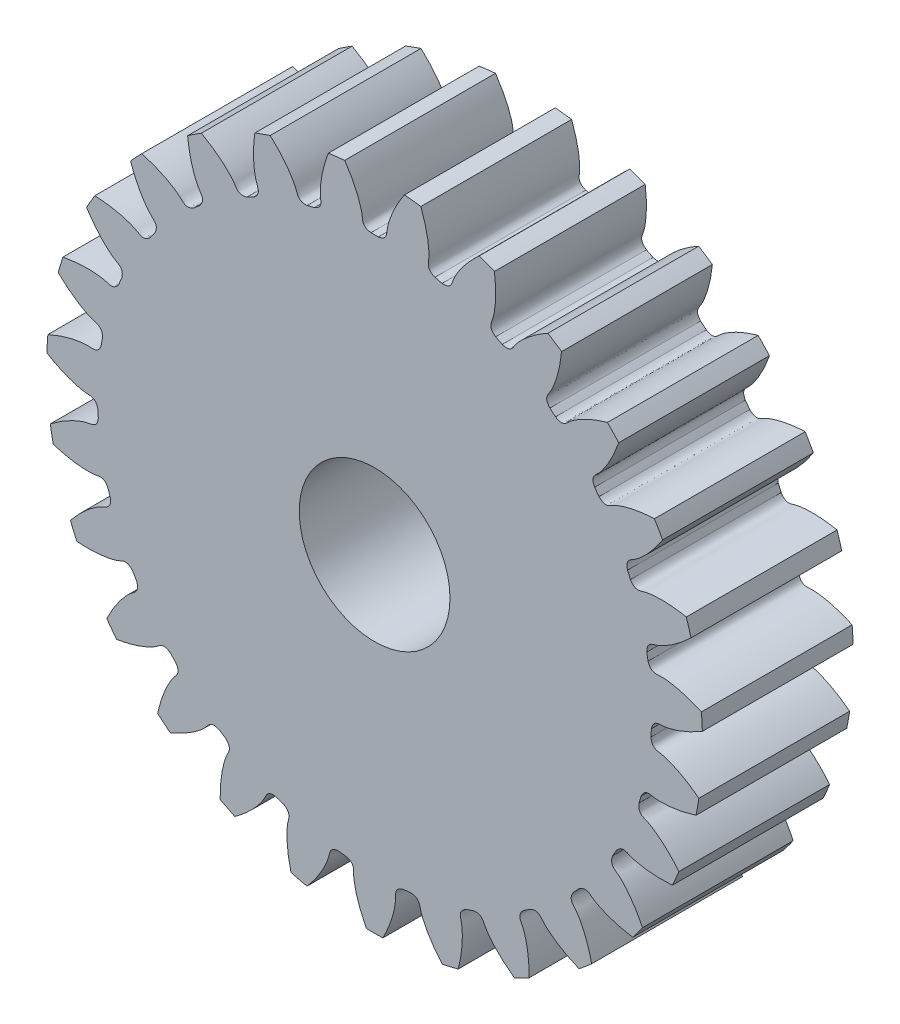
from build123d import *

# Parameters (mm, degrees)
SKETCH_1_R               = 8.700000003
EXTRUDE_1_DEPTH          = 4
CUT_EXTRUDE_1_DEPTH      = 13.937542274
PATTERN_CIRCULAR_1_COUNT = 27
SKETCH_4_R               = 2
CUT_EXTRUDE_2_DEPTH      = 13.934333831


with BuildPart() as part:
    # 草图1 → 凸台-拉伸1 (new body)
    with BuildSketch(Plane.XY):
        Circle(SKETCH_1_R)
    extrude(amount=EXTRUDE_1_DEPTH)

    # 草图2 → 切除-拉伸1 (cut, through all)
    with BuildSketch(Plane.XY):
        with BuildLine():
            ThreePointArc((0.097156647, 7.349357835), (0, 7.35), (-0.097156647, 7.349357835))
            add(Edge.make_bspline(
                [(-0.097156647, 7.349357835), (-0.332065156, 7.387188228), (-0.315047014, 7.52305448), (-0.336367355, 7.659749691), (-0.339792052, 7.67924215), (-0.344194706, 7.701649367), (-0.349687886, 7.726940099), (-0.356390106, 7.755078086), (-0.364416622, 7.786024035), (-0.373882288, 7.819735011), (-0.384900524, 7.85616467), (-0.397583521, 7.89526323), (-0.412042052, 7.936977517), (-0.428385415, 7.981251003), (-0.446721333, 8.028023843), (-0.467155865, 8.077232914), (-0.489793322, 8.128811862), (-0.514736175, 8.182691143), (-0.542084976, 8.238798073), (-0.571938268, 8.297056877), (-0.604392504, 8.357388739), (-0.639541965, 8.419711859), (-0.677478678, 8.483941507), (-0.718292341, 8.54999008), (-0.762070239, 8.617767161), (-0.808897172, 8.687179585), (-0.85885538, 8.758131499), (-0.912024466, 8.830524428), (-0.96848133, 8.904257345), (-1.028300094, 8.979226735), (-1.091552037, 9.055326672), (-1.158305525, 9.132448887), (-1.22862595, 9.210482848), (-1.302575664, 9.289315828), (-1.380213922, 9.368832989), (-1.461596814, 9.448917462), (-1.546777224, 9.52945042), (-1.635804737, 9.610311172), (-1.761228926, 9.719733673), (-1.858936884, 9.799885494), (-1.925888885, 9.852656038)],
                knots=[0, 0, 0, 0, 0.119961604, 0.125268853, 0.131541057, 0.138778215, 0.146980327, 0.156147394, 0.166279415, 0.17737639, 0.18943832, 0.202465204, 0.216457043, 0.231413836, 0.247335583, 0.264222285, 0.282073941, 0.300890552, 0.320672116, 0.341418636, 0.363130109, 0.385806537, 0.409447919, 0.434054256, 0.459625547, 0.486161793, 0.513662993, 0.542129147, 0.571560255, 0.601956318, 0.633317336, 0.665643307, 0.698934234, 0.733190114, 0.768410949, 0.804596738, 0.841747482, 0.87986318, 0.918943832, 1, 1, 1, 1], degree=3))
            ThreePointArc((-1.925888885, 9.852656038), (0, 10.039117442), (1.925888885, 9.852656038))
            add(Edge.make_bspline(
                [(0.097156647, 7.349357835), (0.332065156, 7.387188228), (0.315047014, 7.52305448), (0.336367355, 7.659749691), (0.339792052, 7.67924215), (0.344194706, 7.701649367), (0.349687886, 7.726940099), (0.356390106, 7.755078086), (0.364416622, 7.786024035), (0.373882288, 7.819735011), (0.384900524, 7.85616467), (0.397583521, 7.89526323), (0.412042052, 7.936977517), (0.428385415, 7.981251003), (0.446721333, 8.028023843), (0.467155865, 8.077232914), (0.489793322, 8.128811862), (0.514736175, 8.182691143), (0.542084976, 8.238798073), (0.571938268, 8.297056877), (0.604392504, 8.357388739), (0.639541965, 8.419711859), (0.677478678, 8.483941507), (0.718292341, 8.54999008), (0.762070239, 8.617767161), (0.808897172, 8.687179585), (0.85885538, 8.758131499), (0.912024466, 8.830524428), (0.96848133, 8.904257345), (1.028300094, 8.979226735), (1.091552037, 9.055326672), (1.158305525, 9.132448887), (1.22862595, 9.210482848), (1.302575664, 9.289315828), (1.380213922, 9.368832989), (1.461596814, 9.448917462), (1.546777224, 9.52945042), (1.635804737, 9.610311172), (1.761228926, 9.719733673), (1.858936884, 9.799885494), (1.925888885, 9.852656038)],
                knots=[0, 0, 0, 0, 0.119961604, 0.125268853, 0.131541057, 0.138778215, 0.146980327, 0.156147394, 0.166279415, 0.17737639, 0.18943832, 0.202465204, 0.216457043, 0.231413836, 0.247335583, 0.264222285, 0.282073941, 0.300890552, 0.320672116, 0.341418636, 0.363130109, 0.385806537, 0.409447919, 0.434054256, 0.459625547, 0.486161793, 0.513662993, 0.542129147, 0.571560255, 0.601956318, 0.633317336, 0.665643307, 0.698934234, 0.733190114, 0.768410949, 0.804596738, 0.841747482, 0.87986318, 0.918943832, 1, 1, 1, 1], degree=3))
        make_face()
    cut_extrude_1 = extrude(amount=CUT_EXTRUDE_1_DEPTH, mode=Mode.SUBTRACT)

    # 阵列(圆周)1: 切除-拉伸1 ×27 about axis
    pattern_circular_1_axis = Axis((0, 0, 4), (0, 0, -1))
    for i in range(1, PATTERN_CIRCULAR_1_COUNT):
        add(cut_extrude_1.rotate(pattern_circular_1_axis, i * 360 / PATTERN_CIRCULAR_1_COUNT), mode=Mode.SUBTRACT)

    # 草图4 → 切除-拉伸2 (cut, through all)
    with BuildSketch(Plane.XY.offset(4)):
        Circle(SKETCH_4_R)
    extrude(amount=-CUT_EXTRUDE_2_DEPTH, mode=Mode.SUBTRACT)


solid = part.part
